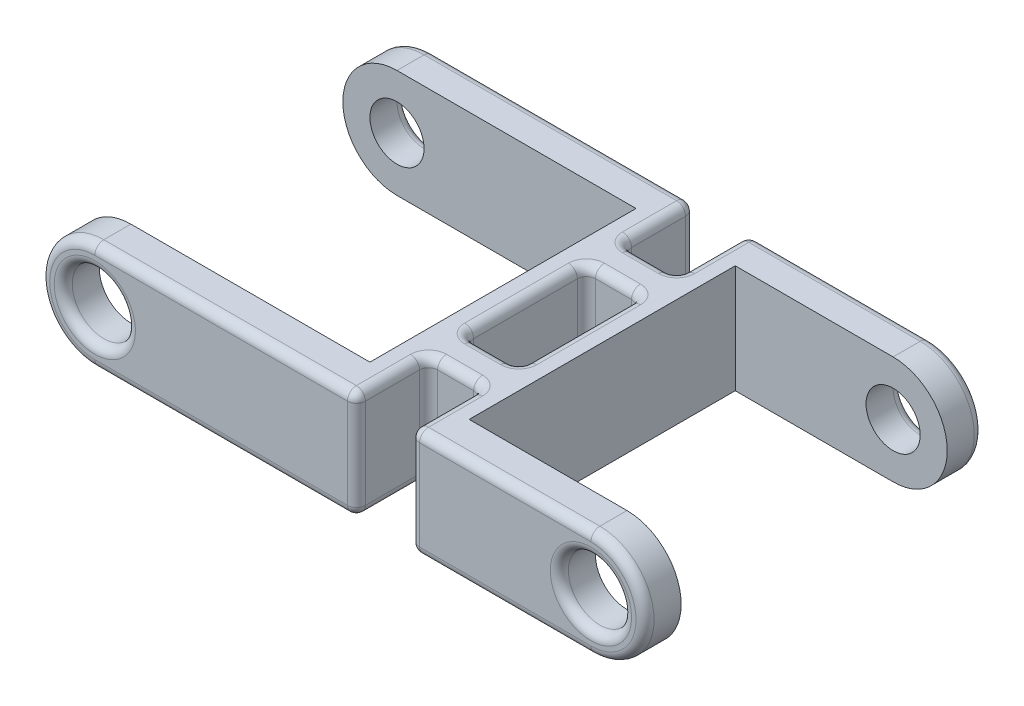
from build123d import *

# Parameters (mm, degrees)
SKETCH1_W           = 37.5
SKETCH1_H           = 12
BOSS_EXTRUDE1_DEPTH = 2.5
SKETCH3_R           = 3
BOSS_EXTRUDE2_DEPTH = 4
BOSS_EXTRUDE3_START = -4
SKETCH4_R           = 3.5
BOSS_EXTRUDE3_DEPTH = 4
SKETCH5_W           = 4
SKETCH5_H           = 12
BOSS_EXTRUDE4_DEPTH = 6
SKETCH6_W           = 37.5
SKETCH6_H           = 12
BOSS_EXTRUDE5_DEPTH = 2.5
SKETCH8_R           = 3.5
BOSS_EXTRUDE6_DEPTH = 4
BOSS_EXTRUDE7_START = -4
SKETCH9_R           = 3
BOSS_EXTRUDE7_DEPTH = 4
FILLET1_R           = 1


with BuildPart() as part:
    # Sketch1 → Boss-Extrude1 (new body)
    with BuildSketch(Plane(origin=(0, 0, 0), x_dir=(0, 0, -1), z_dir=(1, 0, 0))):
        with Locations((-1.111660079, 1.336956522)):
            Rectangle(SKETCH1_W, SKETCH1_H)
    extrude(amount=BOSS_EXTRUDE1_DEPTH)

    # Sketch3 → Boss-Extrude2 (add)
    with BuildSketch(Plane(origin=(0, 0, -17.638339921), x_dir=(-1, 0, 0), z_dir=(0, 0, -1))):
        with BuildLine():
            Line((0, 7.336956522), (26.5, 7.336956522))
            ThreePointArc((26.5, 7.336956522), (32.5, 1.336956522), (26.5, -4.663043478))
            Line((26.5, -4.663043478), (0, -4.663043478))
            Line((0, -4.663043478), (0, 7.336956522))
        make_face()
        with Locations(Location((26.5, 1.336956522, 0), (0, 0, 90))):
            Circle(SKETCH3_R, mode=Mode.SUBTRACT)
    extrude(amount=-BOSS_EXTRUDE2_DEPTH)

    # Sketch4 → Boss-Extrude3 (add)
    with BuildSketch(Plane.XY.offset(19.861660079).offset(BOSS_EXTRUDE3_START)):
        with BuildLine():
            Line((0, 7.336956522), (-26.5, 7.336956522))
            ThreePointArc((-26.5, 7.336956522), (-32.5, 1.336956522), (-26.5, -4.663043478))
            Line((-26.5, -4.663043478), (0, -4.663043478))
            Line((0, -4.663043478), (0, 7.336956522))
        make_face()
        with Locations((-26.5, 1.336956522)):
            Circle(SKETCH4_R, mode=Mode.SUBTRACT)
    extrude(amount=BOSS_EXTRUDE3_DEPTH)

    # Sketch5 → Boss-Extrude4 (add)
    with BuildSketch(Plane(origin=(2.5, 0, 0), x_dir=(0, 0, -1), z_dir=(1, 0, 0))):
        with Locations((-9.861660079, 1.336956522)):
            Rectangle(SKETCH5_W, SKETCH5_H)
        with Locations((7.638339921, 1.336956522)):
            Rectangle(SKETCH5_W, SKETCH5_H)
    extrude(amount=BOSS_EXTRUDE4_DEPTH)

    # Sketch6 → Boss-Extrude5 (add)
    with BuildSketch(Plane(origin=(8.5, 0, 0), x_dir=(0, 0, -1), z_dir=(1, 0, 0))):
        with Locations((-1.111660079, 1.336956522)):
            Rectangle(SKETCH6_W, SKETCH6_H)
    extrude(amount=BOSS_EXTRUDE5_DEPTH)

    # Sketch8 → Boss-Extrude6 (add)
    with BuildSketch(Plane.XY.offset(19.861660079)):
        with BuildLine():
            Line((11, 7.336956522), (28.5, 7.336956522))
            ThreePointArc((28.5, 7.336956522), (34.5, 1.336956522), (28.5, -4.663043478))
            Line((28.5, -4.663043478), (11, -4.663043478))
            Line((11, -4.663043478), (11, 7.336956522))
        make_face()
        with Locations((28.5, 1.336956522)):
            Circle(SKETCH8_R, mode=Mode.SUBTRACT)
    extrude(amount=-BOSS_EXTRUDE6_DEPTH)

    # Sketch9 → Boss-Extrude7 (add)
    with BuildSketch(Plane(origin=(0, 0, -17.638339921), x_dir=(-1, 0, 0), z_dir=(0, 0, -1)).offset(BOSS_EXTRUDE7_START)):
        with BuildLine():
            Line((-11, 7.336956522), (-28.5, 7.336956522))
            ThreePointArc((-28.5, 7.336956522), (-34.5, 1.336956522), (-28.5, -4.663043478))
            Line((-28.5, -4.663043478), (-11, -4.663043478))
            Line((-11, -4.663043478), (-11, 7.336956522))
        make_face()
        with Locations((-28.5, 1.336956522)):
            Circle(SKETCH9_R, mode=Mode.SUBTRACT)
    extrude(amount=BOSS_EXTRUDE7_DEPTH)

    # Fillet1
    fillet1_edges = [part.edges().sort_by_distance(p)[0] for p in [
        (34.5, 1.336956522, -17.638339921),
        (31.5, 1.336956522, -17.638339921),
        (2.5, 1.336956522, -17.638339921),
        (2.5, 7.336956522, -13.638339921),
        (-32.5, 1.336956522, -17.638339921),
        (-26.5, -1.663043478, -17.638339921),
        (-32.5, 1.336956522, 19.861660079),
        (-30, 1.336956522, 19.861660079),
        (2.5, -4.663043478, 1.111660079),
        (2.5, 7.336956522, 15.861660079),
        (2.5, 1.336956522, 11.861660079),
        (5.5, 7.336956522, 11.861660079),
        (5.5, -4.663043478, 11.861660079),
        (2.5, 1.336956522, 7.861660079),
        (5.5, -4.663043478, 7.861660079),
        (5.5, 7.336956522, 7.861660079),
        (8.5, 1.336956522, 11.861660079),
        (8.5, 1.336956522, 7.861660079),
        (2.5, 1.336956522, 19.861660079),
        (2.5, -4.663043478, -13.638339921),
        (2.5, 7.336956522, 1.111660079),
        (5.5, -4.663043478, -5.638339921),
        (2.5, 1.336956522, -9.638339921),
        (5.5, -4.663043478, -9.638339921),
        (5.5, 7.336956522, -9.638339921),
        (2.5, 1.336956522, -5.638339921),
        (5.5, 7.336956522, -5.638339921),
        (8.5, 1.336956522, -9.638339921),
        (8.5, 1.336956522, -5.638339921),
        (8.5, 1.336956522, 19.861660079),
        (18.5, 7.336956522, 19.861660079),
        (8.5, -4.663043478, 15.861660079),
        (8.5, -4.663043478, 1.111660079),
        (8.5, -4.663043478, -13.638339921),
        (18.5, -4.663043478, 19.861660079),
        (8.5, 1.336956522, -17.638339921),
        (18.5, -4.663043478, -17.638339921),
        (8.5, 7.336956522, -13.638339921),
        (8.5, 7.336956522, 1.111660079),
        (8.5, 7.336956522, 15.861660079),
        (18.5, 7.336956522, -17.638339921),
        (-12, 7.336956522, 19.861660079),
        (-12, 7.336956522, -17.638339921),
        (-12, -4.663043478, -17.638339921),
        (-12, -4.663043478, 19.861660079),
        (2.5, -4.663043478, 15.861660079),
        (34.5, 1.336956522, 19.861660079),
        (25, 1.336956522, 19.861660079),
    ]]
    fillet(fillet1_edges, radius=FILLET1_R)


solid = part.part
